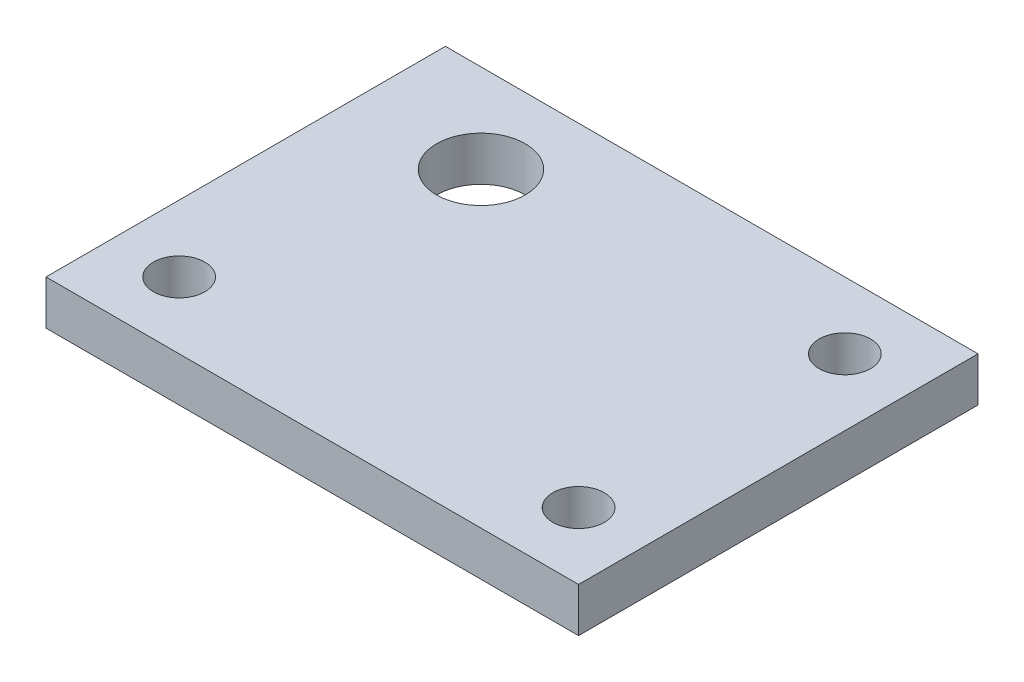
from build123d import *

# Parameters (mm, degrees)
SKETCH1_W           = 38.1
SKETCH1_H           = 28.575
SKETCH1_R           = 3.175
BOSS_EXTRUDE1_DEPTH = 3.175
SKETCH2_R           = 1.8415
CUT_EXTRUDE1_DEPTH  = 25.023234196


with BuildPart() as part:
    # Sketch1 → Boss-Extrude1 (new body)
    with BuildSketch(Plane(origin=(0, 0, 0), x_dir=(1, 0, 0), z_dir=(0, 1, 0))):
        Rectangle(SKETCH1_W, SKETCH1_H)
        with Locations(Location((-10.16, 7.9375, 0), (0, 0, 270))):
            Circle(SKETCH1_R, mode=Mode.SUBTRACT)
    extrude(amount=BOSS_EXTRUDE1_DEPTH)

    # Sketch2 → Cut-Extrude1 (cut, through all)
    with BuildSketch(Plane(origin=(0, 3.175, 0), x_dir=(1, 0, 0), z_dir=(0, 1, 0))):
        with Locations(Location((-14.2875, -9.525, 0), (0, 0, 270))):
            Circle(SKETCH2_R)
        with Locations(Location((14.2875, -9.525, 0), (0, 0, 270))):
            Circle(SKETCH2_R)
        with Locations(Location((14.2875, 9.525, 0), (0, 0, 270))):
            Circle(SKETCH2_R)
    extrude(amount=-CUT_EXTRUDE1_DEPTH, mode=Mode.SUBTRACT)


solid = part.part
